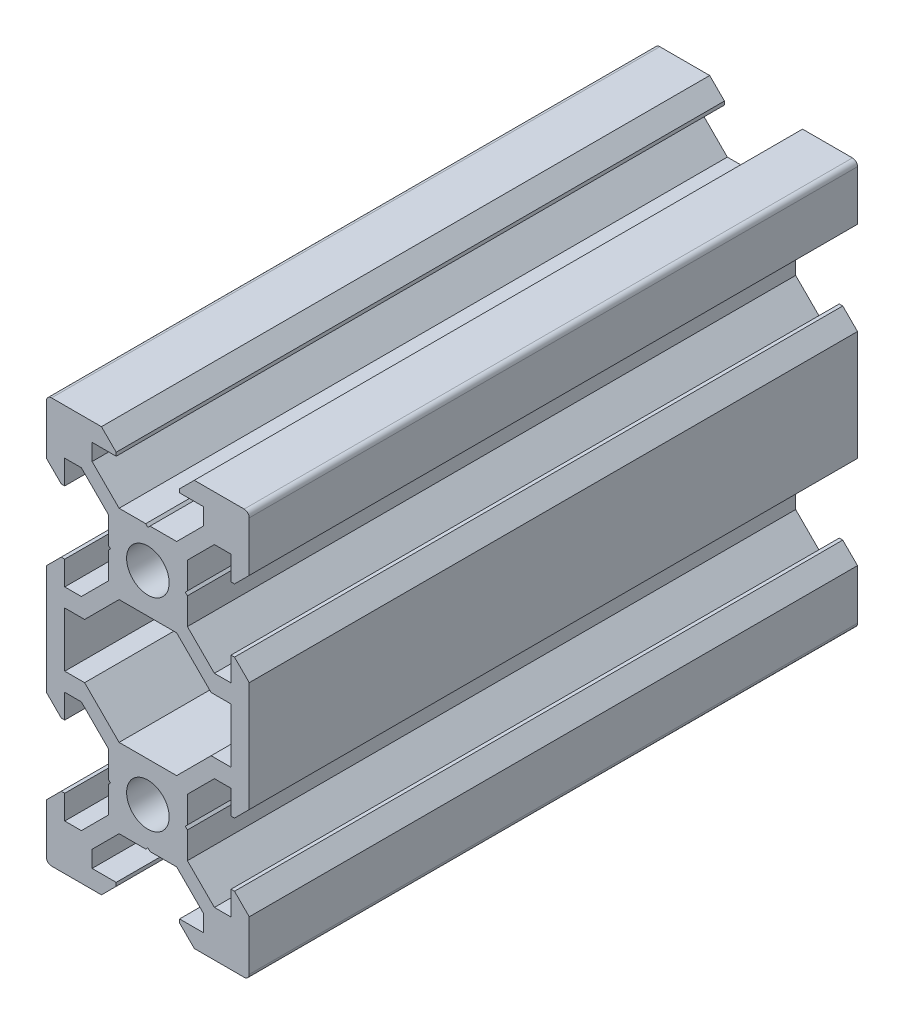
from build123d import *

# Parameters (mm, degrees)
SKETCH1_R           = 2.1
BOSS_EXTRUDE1_DEPTH = 60


with BuildPart() as part:
    # Sketch1 → Boss-Extrude1 (new body)
    with BuildSketch(Plane.XY):
        with BuildLine():
            Line((4.58, -20), (9.5, -20))
            ThreePointArc((9.5, -20), (9.853553391, -19.853553391), (10, -19.5))
            Line((10, -19.5), (10, -14.58))
            Line((10, -14.58), (8.545, -13.125))
            Line((8.545, -13.125), (8.2, -13.125))
            Line((8.2, -13.125), (8.2, -15.5))
            Line((8.2, -15.5), (6.560660172, -15.5))
            Line((6.560660172, -15.5), (3.9, -12.839339828))
            Line((3.9, -12.839339828), (3.9, -10.21))
            Line((3.9, -10.21), (3.69, -10))
            Line((3.69, -10), (3.9, -9.79))
            Line((3.9, -9.79), (3.9, -7.160660172))
            Line((3.9, -7.160660172), (6.560660172, -4.5))
            Line((6.560660172, -4.5), (8.2, -4.5))
            Line((8.2, -4.5), (8.2, -6.875))
            Line((8.2, -6.875), (8.545, -6.875))
            Line((8.545, -6.875), (10, -5.42))
            Line((10, -5.42), (10, 5.42))
            Line((10, 5.42), (8.545, 6.875))
            Line((8.545, 6.875), (8.2, 6.875))
            Line((8.2, 6.875), (8.2, 4.5))
            Line((8.2, 4.5), (6.560660172, 4.5))
            Line((6.560660172, 4.5), (3.9, 7.160660172))
            Line((3.9, 7.160660172), (3.9, 9.79))
            Line((3.9, 9.79), (3.69, 10))
            Line((3.69, 10), (3.9, 10.21))
            Line((3.9, 10.21), (3.9, 12.839339828))
            Line((3.9, 12.839339828), (6.560660172, 15.5))
            Line((6.560660172, 15.5), (8.2, 15.5))
            Line((8.2, 15.5), (8.2, 13.125))
            Line((8.2, 13.125), (8.545, 13.125))
            Line((8.545, 13.125), (10, 14.58))
            Line((10, 14.58), (10, 19.5))
            ThreePointArc((10, 19.5), (9.853553391, 19.853553391), (9.5, 20))
            Line((9.5, 20), (4.58, 20))
            Line((4.58, 20), (3.125, 18.545))
            Line((3.125, 18.545), (3.125, 18.2))
            Line((3.125, 18.2), (5.5, 18.2))
            Line((5.5, 18.2), (5.5, 16.560660172))
            Line((5.5, 16.560660172), (2.839339828, 13.9))
            Line((2.839339828, 13.9), (0.21, 13.9))
            Line((0.21, 13.9), (0, 13.69))
            Line((0, 13.69), (-0.21, 13.9))
            Line((-0.21, 13.9), (-2.839339828, 13.9))
            Line((-2.839339828, 13.9), (-5.5, 16.560660172))
            Line((-5.5, 16.560660172), (-5.5, 18.2))
            Line((-5.5, 18.2), (-3.125, 18.2))
            Line((-3.125, 18.2), (-3.125, 18.545))
            Line((-3.125, 18.545), (-4.58, 20))
            Line((-4.58, 20), (-9.5, 20))
            ThreePointArc((-9.5, 20), (-9.853553391, 19.853553391), (-10, 19.5))
            Line((-10, 19.5), (-10, 14.58))
            Line((-10, 14.58), (-8.545, 13.125))
            Line((-8.545, 13.125), (-8.2, 13.125))
            Line((-8.2, 13.125), (-8.2, 15.5))
            Line((-8.2, 15.5), (-6.560660172, 15.5))
            Line((-6.560660172, 15.5), (-3.9, 12.839339828))
            Line((-3.9, 12.839339828), (-3.9, 10.21))
            Line((-3.9, 10.21), (-3.69, 10))
            Line((-3.69, 10), (-3.9, 9.79))
            Line((-3.9, 9.79), (-3.9, 7.160660172))
            Line((-3.9, 7.160660172), (-6.560660172, 4.5))
            Line((-6.560660172, 4.5), (-8.2, 4.5))
            Line((-8.2, 4.5), (-8.2, 6.875))
            Line((-8.2, 6.875), (-8.545, 6.875))
            Line((-8.545, 6.875), (-10, 5.42))
            Line((-10, 5.42), (-10, -5.42))
            Line((-10, -5.42), (-8.545, -6.875))
            Line((-8.545, -6.875), (-8.2, -6.875))
            Line((-8.2, -6.875), (-8.2, -4.5))
            Line((-8.2, -4.5), (-6.560660172, -4.5))
            Line((-6.560660172, -4.5), (-3.9, -7.160660172))
            Line((-3.9, -7.160660172), (-3.9, -9.79))
            Line((-3.9, -9.79), (-3.69, -10))
            Line((-3.69, -10), (-3.9, -10.21))
            Line((-3.9, -10.21), (-3.9, -12.839339828))
            Line((-3.9, -12.839339828), (-6.560660172, -15.5))
            Line((-6.560660172, -15.5), (-8.2, -15.5))
            Line((-8.2, -15.5), (-8.2, -13.125))
            Line((-8.2, -13.125), (-8.545, -13.125))
            Line((-8.545, -13.125), (-10, -14.58))
            Line((-10, -14.58), (-10, -19.5))
            ThreePointArc((-10, -19.5), (-9.853553391, -19.853553391), (-9.5, -20))
            Line((-9.5, -20), (-4.58, -20))
            Line((-4.58, -20), (-3.125, -18.545))
            Line((-3.125, -18.545), (-3.125, -18.2))
            Line((-3.125, -18.2), (-5.5, -18.2))
            Line((-5.5, -18.2), (-5.5, -16.560660172))
            Line((-5.5, -16.560660172), (-2.839339828, -13.9))
            Line((-2.839339828, -13.9), (-0.21, -13.9))
            Line((-0.21, -13.9), (0, -13.69))
            Line((0, -13.69), (0.21, -13.9))
            Line((0.21, -13.9), (2.839339828, -13.9))
            Line((2.839339828, -13.9), (5.5, -16.560660172))
            Line((5.5, -16.560660172), (5.5, -18.2))
            Line((5.5, -18.2), (3.125, -18.2))
            Line((3.125, -18.2), (3.125, -18.545))
            Line((3.125, -18.545), (4.58, -20))
        make_face()
        with Locations((0, -10)):
            Circle(SKETCH1_R, mode=Mode.SUBTRACT)
        Polygon((-6.239339828, -2.7), (-8.2, -2.7), (-8.2, 2.7), (-6.239339828, 2.7), (-2.839339828, 6.1), (2.839339828, 6.1), (6.239339828, 2.7), (8.2, 2.7), (8.2, -2.7), (6.239339828, -2.7), (2.839339828, -6.1), (-2.839339828, -6.1), align=None, mode=Mode.SUBTRACT)
        with Locations((0, 10)):
            Circle(SKETCH1_R, mode=Mode.SUBTRACT)
    extrude(amount=BOSS_EXTRUDE1_DEPTH)


solid = part.part
